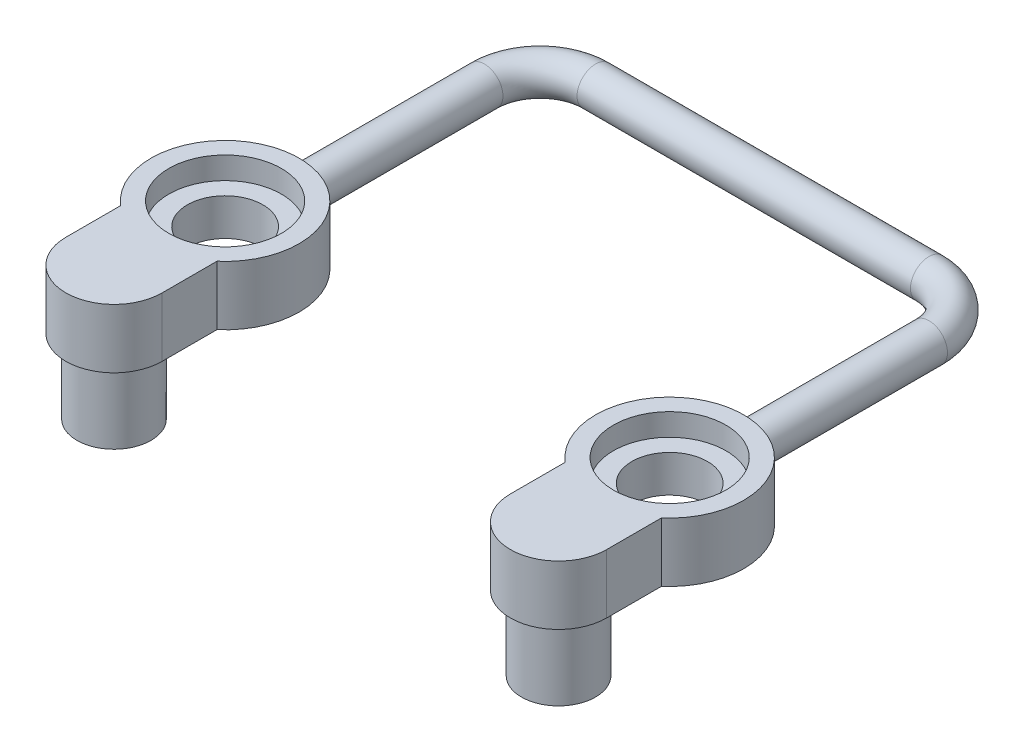
from build123d import *

# Parameters (mm, degrees)
SKETCH1_R             = 6.477
BOSS_EXTRUDE1_DEPTH   = 5.08
BOSS_EXTRUDE1_2_DEPTH = 5.08
SKETCH2_R             = 6.35
BOSS_EXTRUDE2_DEPTH   = 12.7
SKETCH3_R             = 9.652
CUT_EXTRUDE1_DEPTH    = 3.81
SKETCH5_R             = 3.175


with BuildPart() as part:
    # Sketch1 → Boss-Extrude1 (new, symmetric)
    with BuildSketch(Plane(origin=(0, 0, 0), x_dir=(1, 0, 0), z_dir=(0, 1, 0))):
        with BuildLine():
            Line((-46.355, -19.05), (-46.355, -9.651164438))
            ThreePointArc((-46.355, -9.651164438), (-38.1, 12.7), (-29.845, -9.651164438))
            Line((-29.845, -9.651164438), (-29.845, -19.05))
            ThreePointArc((-29.845, -19.05), (-38.1, -27.305), (-46.355, -19.05))
        make_face()
        with Locations(Location((-38.1, 0, 0), (0, 0, 270))):
            Circle(SKETCH1_R, mode=Mode.SUBTRACT)
    extrude(amount=BOSS_EXTRUDE1_DEPTH, both=True)



with BuildPart() as body_2:
    # Sketch1 → Boss-Extrude1 2 (new, symmetric)
    with BuildSketch(Plane(origin=(0, 0, 0), x_dir=(1, 0, 0), z_dir=(0, 1, 0))):
        with BuildLine():
            Line((29.845, -19.05), (29.845, -9.651164438))
            ThreePointArc((29.845, -9.651164438), (38.1, 12.7), (46.355, -9.651164438))
            Line((46.355, -9.651164438), (46.355, -19.05))
            ThreePointArc((46.355, -19.05), (38.1, -27.305), (29.845, -19.05))
        make_face()
        with Locations(Location((38.1, 0, 0), (0, 0, 90))):
            Circle(SKETCH1_R, mode=Mode.SUBTRACT)
    extrude(amount=BOSS_EXTRUDE1_2_DEPTH, both=True)


with BuildPart() as part_1:
    add(part.part)

    add(body_2.part)  # Boss-Extrude2 merges body 2
    # Sketch2 → Boss-Extrude2 (add)
    with BuildSketch(Plane.XZ.offset(5.08)):
        with Locations(Location((-38.1, 19.05, 0), (0, 0, 270))):
            Circle(SKETCH2_R)
        with Locations(Location((38.1, 19.05, 0), (0, 0, 270))):
            Circle(SKETCH2_R)
    extrude(amount=BOSS_EXTRUDE2_DEPTH)

    # Sketch3 → Cut-Extrude1 (cut)
    with BuildSketch(Plane(origin=(0, 5.08, 0), x_dir=(1, 0, 0), z_dir=(0, 1, 0))):
        with Locations(Location((-38.1, 0, 0), (0, 0, 270))):
            Circle(SKETCH3_R)
        with Locations(Location((38.1, 0, 0), (0, 0, 270))):
            Circle(SKETCH3_R)
    extrude(amount=-CUT_EXTRUDE1_DEPTH, mode=Mode.SUBTRACT)

    # Sweep1: sweep along a path in Sketch6
    with BuildLine(Plane(origin=(0, 0, 0), x_dir=(1, 0, 0), z_dir=(0, 1, 0))) as sweep1_path:
        Line((38.1, 12.192), (38.1, 44.45))
        ThreePointArc((38.1, 44.45), (35.310192091, 51.185192091), (28.575, 53.975))
        Line((28.575, 53.975), (-28.575, 53.975))
        ThreePointArc((-28.575, 53.975), (-35.310192091, 51.185192091), (-38.1, 44.45))
        Line((-38.1, 44.45), (-38.1, 12.192))
    # Sketch5 → Sweep1 (sweep)
    with BuildSketch(Plane.XY.offset(-12.192)):
        with Locations((38.1, 0)):
            Circle(SKETCH5_R)
    sweep(path=sweep1_path.line)


solid = part_1.part
